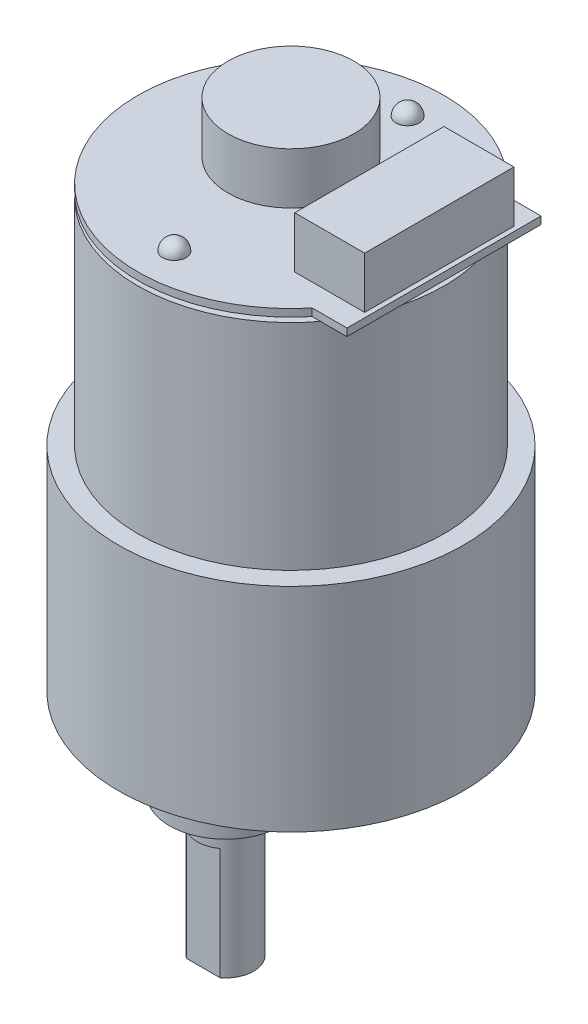
from build123d import *

# Parameters (mm, degrees)
SKETCH1_R            = 16.4
BOSS_EXTRUDE1_DEPTH  = 23
SKETCH2_R            = 1.25
BOSS_EXTRUDE2_DEPTH  = 0.5
SKETCH4_R            = 18.5
BOSS_EXTRUDE4_DEPTH  = 22.8
CUT_EXTRUDE1_DEPTH   = 1
SKETCH6_R            = 6.006706661
BOSS_EXTRUDE5_DEPTH  = 6
SKETCH7_R            = 3
BOSS_EXTRUDE6_DEPTH  = 15
CUT_EXTRUDE2_START   = -12
CUT_EXTRUDE2_DEPTH   = 12
BOSS_EXTRUDE7_DEPTH  = 0.8
REVOLVE4_ANGLE       = 180
SKETCH13_R           = 1
BOSS_EXTRUDE9_DEPTH  = 2.5
SKETCH14_R           = 6.75
BOSS_EXTRUDE10_DEPTH = 5.5
SKETCH15_W           = 7.5
SKETCH15_H           = 16
BOSS_EXTRUDE11_DEPTH = 5.5


with BuildPart() as part:
    # Sketch1 → Boss-Extrude1 (new body)
    with BuildSketch(Plane(origin=(0, 0, 0), x_dir=(-1, 0, 0), z_dir=(0, 1, 0))):
        with Locations(Location((0, 0, 0), (0, 0, 90))):
            Circle(SKETCH1_R)
    extrude(amount=BOSS_EXTRUDE1_DEPTH)

    # Sketch2 → Boss-Extrude2 (add)
    with BuildSketch(Plane(origin=(0, 23, 0), x_dir=(-1, 0, 0), z_dir=(0, 1, 0))):
        with Locations(Location((0, 12.5, 0), (0, 0, 90))):
            Circle(SKETCH2_R)
        with Locations(Location((0, -12.5, 0), (0, 0, 90))):
            Circle(SKETCH2_R)
    extrude(amount=BOSS_EXTRUDE2_DEPTH)

    # Sketch4 → Boss-Extrude4 (add)
    with BuildSketch(Plane.XZ):
        with Locations(Location((0, 0, 0), (0, 0, 270))):
            Circle(SKETCH4_R)
    extrude(amount=BOSS_EXTRUDE4_DEPTH)

    # Sketch5 → Cut-Extrude1 (cut)
    with BuildSketch(Plane.XZ.offset(22.8)):
        with BuildLine():
            ThreePointArc((-8.811209519, 8.866373938), (0, -12.5), (8.811209519, 8.866373938))
            ThreePointArc((8.811209519, 8.866373938), (0, -2.006706661), (-8.811209519, 8.866373938))
        make_face()
    extrude(amount=-CUT_EXTRUDE1_DEPTH, mode=Mode.SUBTRACT)

    # Sketch6 → Boss-Extrude5 (add)
    with BuildSketch(Plane.XZ.offset(22.8)):
        with Locations(Location((0, 7, 0), (0, 0, 270))):
            Circle(SKETCH6_R)
    extrude(amount=BOSS_EXTRUDE5_DEPTH)

    # Sketch7 → Boss-Extrude6 (add)
    with BuildSketch(Plane.XZ.offset(28.8)):
        with Locations(Location((0, 7, 0), (0, 0, 270))):
            Circle(SKETCH7_R)
    extrude(amount=BOSS_EXTRUDE6_DEPTH)

    # Sketch8 → Cut-Extrude2 (cut)
    with BuildSketch(Plane.XZ.offset(43.8).offset(CUT_EXTRUDE2_START)):
        with BuildLine():
            Line((-1.8, 9.4), (1.8, 9.4))
            ThreePointArc((1.8, 9.4), (0, 10), (-1.8, 9.4))
        make_face()
    extrude(amount=CUT_EXTRUDE2_DEPTH, mode=Mode.SUBTRACT)

    # Sketch9 → Boss-Extrude7 (add)
    with BuildSketch(Plane(origin=(0, 23.5, 0), x_dir=(-1, 0, 0), z_dir=(0, 1, 0))):
        with BuildLine():
            Line((-12.680693987, 10.4), (-16.4, 10.4))
            Line((-16.4, 10.4), (-16.4, -10.4))
            Line((-16.4, -10.4), (-12.680693987, -10.4))
            ThreePointArc((-12.680693987, -10.4), (16.4, 0), (-12.680693987, 10.4))
        make_face()
    extrude(amount=BOSS_EXTRUDE7_DEPTH)

    # Sketch10 → Revolve4 (revolve)
    with BuildSketch(Plane(origin=(0, 24.3, 0), x_dir=(-1, 0, 0), z_dir=(0, 1, 0))):
        with BuildLine():
            Line((0, 13.75), (0, 11.25))
            ThreePointArc((0, 11.25), (1.25, 12.5), (0, 13.75))
        make_face()
        with BuildLine():
            Line((0, -11.25), (0, -13.75))
            ThreePointArc((0, -13.75), (1.25, -12.5), (0, -11.25))
        make_face()
    revolve(axis=Axis((0, 24.3, 12.5), (0, 0, -1)), revolution_arc=REVOLVE4_ANGLE)

    # Sketch13 → Boss-Extrude9 (add)
    with BuildSketch(Plane(origin=(0, 24.3, 0), x_dir=(-1, 0, 0), z_dir=(0, 1, 0))):
        with Locations(Location((0, 0, 0), (0, 0, 270))):
            Circle(SKETCH13_R)
    extrude(amount=BOSS_EXTRUDE9_DEPTH)

    # Sketch14 → Boss-Extrude10 (add)
    with BuildSketch(Plane(origin=(0, 26.8, 0), x_dir=(-1, 0, 0), z_dir=(0, 1, 0))):
        with Locations(Location((0, 0, 0), (0, 0, 90))):
            Circle(SKETCH14_R)
    extrude(amount=BOSS_EXTRUDE10_DEPTH)

    # Sketch15 → Boss-Extrude11 (add)
    with BuildSketch(Plane(origin=(0, 24.3, 0), x_dir=(-1, 0, 0), z_dir=(0, 1, 0))):
        with Locations((-12.15, 0)):
            Rectangle(SKETCH15_W, SKETCH15_H)
    extrude(amount=BOSS_EXTRUDE11_DEPTH)


solid = part.part
